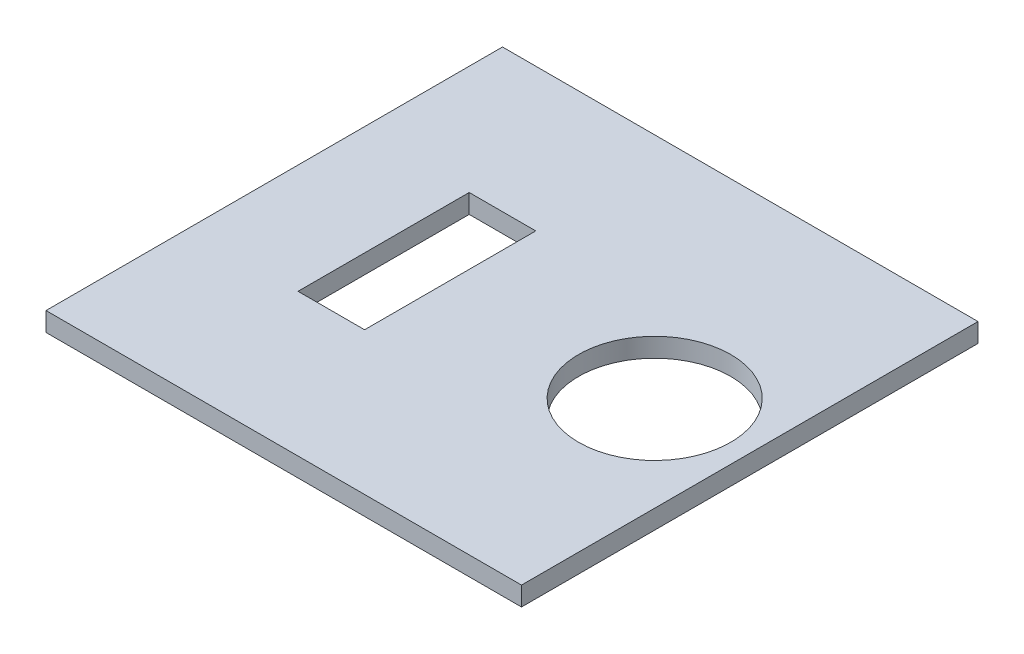
from build123d import *

# Parameters (mm, degrees)
SKETCH1_W           = 25
SKETCH1_H           = 24
SKETCH1_R           = 4
SKETCH1_W_2         = 3.5
SKETCH1_H_2         = 9
BOSS_EXTRUDE1_DEPTH = 1


with BuildPart() as part:
    # Sketch1 → Boss-Extrude1 (new body)
    with BuildSketch(Plane(origin=(0, 0, 0), x_dir=(1, 0, 0), z_dir=(0, 1, 0))):
        Rectangle(SKETCH1_W, SKETCH1_H)
        with Locations(Location((7.5, 0, 0), (0, 0, 270))):
            Circle(SKETCH1_R, mode=Mode.SUBTRACT)
        with Locations((-5, 0)):
            Rectangle(SKETCH1_W_2, SKETCH1_H_2, mode=Mode.SUBTRACT)
    extrude(amount=BOSS_EXTRUDE1_DEPTH)


solid = part.part
